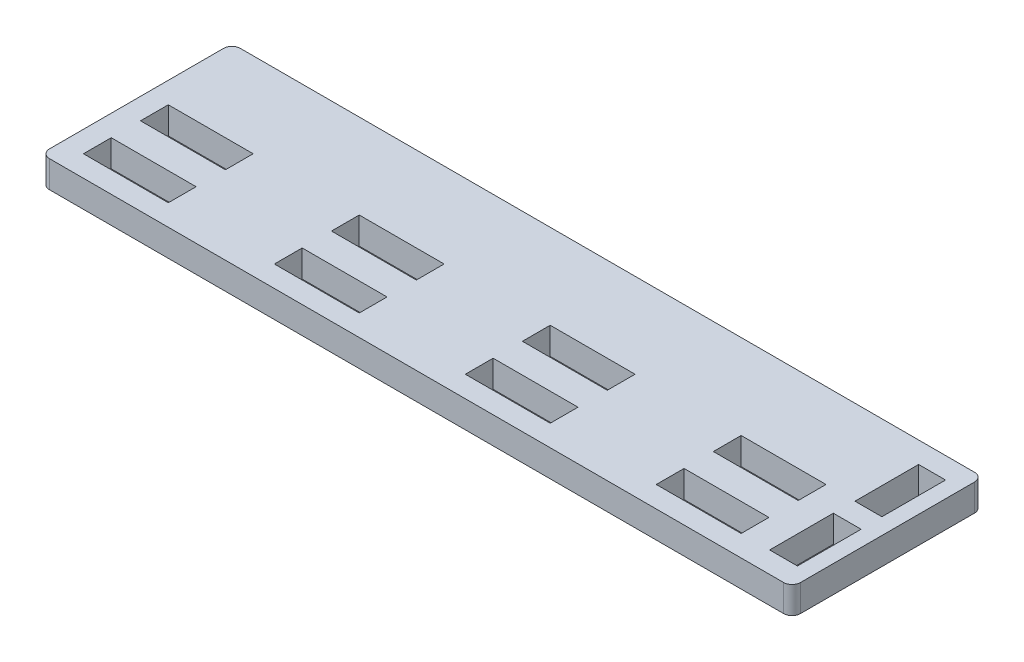
from build123d import *

# Parameters (mm, degrees)
BOSS_EXTRUDE1_DEPTH = 6.35
SKETCH2_W           = 20
SKETCH2_H           = 6.55
CUT_EXTRUDE1_DEPTH  = 172.94569637
SKETCH4_W           = 6.55
SKETCH4_H           = 15
SKETCH4_W_2         = 6.35
CUT_EXTRUDE2_DEPTH  = 172.94569637
FILLET1_R           = 2


with BuildPart() as part:
    # Sketch1 → Boss-Extrude1 (new body)
    with BuildSketch(Plane(origin=(0, 0, 0), x_dir=(1, 0, 0), z_dir=(0, 1, 0))):
        Polygon((-170, 0), (-170, 20), (0, 20), (7, 20), (7, -25), (0, -25), (-170, -25), align=None)
    extrude(amount=BOSS_EXTRUDE1_DEPTH)

    # Sketch2 → Cut-Extrude1 (cut, through all)
    with BuildSketch(Plane(origin=(0, 6.35, 0), x_dir=(1, 0, 0), z_dir=(0, 1, 0))):
        with Locations((-110, -16.725)):
            Rectangle(SKETCH2_W, SKETCH2_H)
        with Locations((-155, -16.725)):
            Rectangle(SKETCH2_W, SKETCH2_H)
        with Locations((-65, -16.725)):
            Rectangle(SKETCH2_W, SKETCH2_H)
        with Locations((-20, -16.725)):
            Rectangle(SKETCH2_W, SKETCH2_H)
        with Locations((-110, -3.275)):
            Rectangle(SKETCH2_W, SKETCH2_H)
        with Locations((-155, -3.275)):
            Rectangle(SKETCH2_W, SKETCH2_H)
        with Locations((-65, -3.275)):
            Rectangle(SKETCH2_W, SKETCH2_H)
        with Locations((-20, -3.275)):
            Rectangle(SKETCH2_W, SKETCH2_H)
    extrude(amount=-CUT_EXTRUDE1_DEPTH, mode=Mode.SUBTRACT)

    # Sketch4 → Cut-Extrude2 (cut, through all)
    with BuildSketch(Plane(origin=(0, 6.35, 0), x_dir=(1, 0, 0), z_dir=(0, 1, 0))):
        with Locations((0, -12.5)):
            Rectangle(SKETCH4_W, SKETCH4_H)
        with Locations((0, 7.5)):
            Rectangle(SKETCH4_W_2, SKETCH4_H)
    extrude(amount=-CUT_EXTRUDE2_DEPTH, mode=Mode.SUBTRACT)

    # Fillet1
    fillet1_edges = [part.edges().sort_by_distance(p)[0] for p in [
        (7, 3.175, -20),
        (7, 3.175, 25),
        (-170, 3.175, 25),
        (-170, 3.175, -20),
    ]]
    fillet(fillet1_edges, radius=FILLET1_R)


solid = part.part
